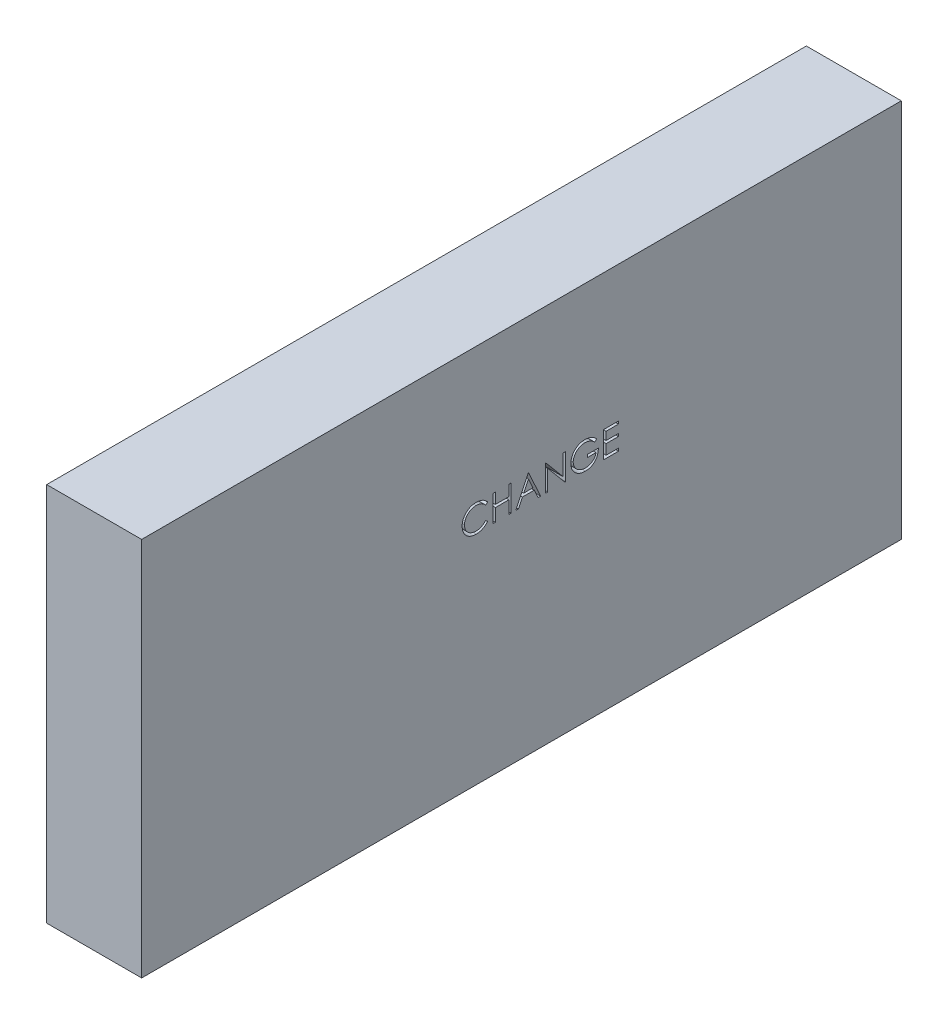
from build123d import *

# Parameters (mm, degrees)
SKETCH1_W          = 12.7
SKETCH1_H          = 50.8
EXTRUDE1_DEPTH     = 50.8
CUT_EXTRUDE1_DEPTH = 59.198711326


with BuildPart() as part:
    # Sketch1 → Extrude1 (new, symmetric)
    with BuildSketch(Plane.XY):
        Rectangle(SKETCH1_W, SKETCH1_H)
    extrude(amount=EXTRUDE1_DEPTH, both=True)

    # Sketch2 → Cut-Extrude1 (cut, through all)
    # profile 1 of 6: a face of its own
    with BuildSketch(Plane(origin=(6.35, 0, 0), x_dir=(0, 0, -1), z_dir=(1, 0, 0))):
        with BuildLine():
            Line((-4.524709295, 6.586952652), (-4.799549039, 6.376616113))
            add(Edge.make_bspline(
                [(-4.799549039, 6.376616113), (-4.819154927, 6.399982083), (-4.858102374, 6.446398999), (-4.920761577, 6.511578543), (-4.986063219, 6.572643805), (-5.053982341, 6.629885684), (-5.12574146, 6.68130245), (-5.199602259, 6.729573553), (-5.276800304, 6.772841291), (-5.383552039, 6.825304277), (-5.523199887, 6.880050432), (-5.698994726, 6.925953663), (-5.882505825, 6.955174839), (-6.007703424, 6.958339681), (-6.071383975, 6.959949447)],
                knots=[0, 0, 0, 0, 0.757959112, 1.505699292, 2.245454638, 2.979532153, 3.711538275, 4.438200793, 5.171680507, 5.909471876, 7.393775596, 8.890124382, 10.418191784, 12, 12, 12, 12], degree=3))
            add(Edge.make_bspline(
                [(-6.071383975, 6.959949447), (-6.106467274, 6.959545484), (-6.176308267, 6.958741308), (-6.27995674, 6.948132183), (-6.381669791, 6.933220973), (-6.481381258, 6.91109565), (-6.578964216, 6.883123031), (-6.675056618, 6.849697617), (-6.768267218, 6.808342777), (-6.859885456, 6.762634517), (-6.947664667, 6.711007072), (-7.030719715, 6.65469372), (-7.108747683, 6.594324624), (-7.181810295, 6.529673517), (-7.249982243, 6.461031557), (-7.312769554, 6.387667215), (-7.369954964, 6.309815042), (-7.422671989, 6.228501634), (-7.469884723, 6.143963843), (-7.509414602, 6.055888772), (-7.544419724, 5.965784669), (-7.572118967, 5.872633508), (-7.594043484, 5.777090743), (-7.609171147, 5.678899955), (-7.619659618, 5.578266275), (-7.620459795, 5.510056962), (-7.620863141, 5.475674607)],
                knots=[0, 0, 0, 0, 1.054917814, 2.100044995, 3.131103042, 4.146048494, 5.169673617, 6.183595914, 7.203665975, 8.234915748, 9.262203917, 10.264457458, 11.251630812, 12.227803204, 13.197192746, 14.159520551, 15.12972552, 16.100847026, 17.073214652, 18.039054194, 19.002613845, 19.979014051, 20.95965708, 21.949030935, 22.966165397, 24, 24, 24, 24], degree=3))
            add(Edge.make_bspline(
                [(-7.620863141, 5.475674607), (-7.619601322, 5.423943287), (-7.617123908, 5.322375702), (-7.595075574, 5.173605092), (-7.561570483, 5.031084418), (-7.511354906, 4.895704575), (-7.449435855, 4.765796217), (-7.371195244, 4.643557364), (-7.280578706, 4.527140799), (-7.176304287, 4.419297852), (-7.061898471, 4.320784126), (-6.939150559, 4.234033545), (-6.808366272, 4.161718662), (-6.670989641, 4.101542716), (-6.525963527, 4.055285988), (-6.373548725, 4.022721865), (-6.21407673, 4.001479684), (-6.10510733, 3.999445996), (-6.049649199, 3.998410985)],
                knots=[0, 0, 0, 0, 1.029171465, 2.020641659, 2.987623507, 3.938342917, 4.889210282, 5.84687017, 6.821220943, 7.821438502, 8.827599549, 9.822697543, 10.807740252, 11.797342354, 12.80366471, 13.83203677, 14.896651826, 16, 16, 16, 16], degree=3))
            add(Edge.make_bspline(
                [(-6.049649199, 3.998410985), (-5.98854651, 4.000099765), (-5.868281801, 4.003423687), (-5.691913775, 4.031582936), (-5.523078009, 4.077240854), (-5.361765423, 4.141138777), (-5.208430776, 4.224204065), (-5.062834116, 4.324901942), (-4.924852546, 4.444190275), (-4.841881263, 4.535273403), (-4.799549039, 4.581744318)],
                knots=[0, 0, 0, 0, 1.028121516, 2.023589091, 2.998037872, 3.967518031, 4.937445131, 5.927275754, 6.942489185, 8, 8, 8, 8], degree=3))
            Line((-4.799549039, 4.581744318), (-4.524709295, 4.373511145))
            add(Edge.make_bspline(
                [(-4.524709295, 4.373511145), (-4.546827405, 4.344972693), (-4.59095768, 4.288032487), (-4.662415697, 4.207760777), (-4.737692995, 4.132256742), (-4.817348705, 4.062129121), (-4.900466496, 3.995974655), (-4.988538809, 3.935672824), (-5.080407841, 3.880381939), (-5.17576232, 3.829755015), (-5.274500933, 3.784837768), (-5.376505368, 3.746384), (-5.481335943, 3.713259111), (-5.588997452, 3.686007174), (-5.699713209, 3.66473609), (-5.813083683, 3.650516415), (-5.929353558, 3.640774501), (-6.007794979, 3.639886585), (-6.047545834, 3.639436626)],
                knots=[0, 0, 0, 0, 0.986787822, 1.968848986, 2.935600012, 3.899624008, 4.868462664, 5.837806735, 6.815139263, 7.798259679, 8.787526145, 9.778297419, 10.776456485, 11.791383307, 12.812564526, 13.85620153, 14.913611965, 16, 16, 16, 16], degree=3))
            add(Edge.make_bspline(
                [(-6.047545834, 3.639436626), (-6.085189501, 3.639698619), (-6.159625191, 3.640216676), (-6.269523943, 3.648608844), (-6.376513523, 3.660058581), (-6.480288149, 3.677298712), (-6.581414124, 3.697643052), (-6.678974709, 3.724914309), (-6.773929919, 3.755463475), (-6.86589826, 3.791368462), (-6.95495796, 3.831884644), (-7.040821771, 3.877676203), (-7.123450203, 3.928358068), (-7.203655624, 3.982813078), (-7.280253208, 4.04279038), (-7.353906733, 4.107457015), (-7.425029209, 4.176595026), (-7.469031894, 4.226449879), (-7.491155609, 4.251515953)],
                knots=[0, 0, 0, 0, 1.114604814, 2.203992996, 3.262667896, 4.300477797, 5.318619304, 6.316056647, 7.298880507, 8.271930387, 9.238335007, 10.195173496, 11.151986948, 12.108099108, 13.064862484, 14.031167946, 15.010108607, 16, 16, 16, 16], degree=3))
            add(Edge.make_bspline(
                [(-7.491155609, 4.251515953), (-7.526591253, 4.295057142), (-7.59703473, 4.381613852), (-7.687160413, 4.521899834), (-7.764307968, 4.668368042), (-7.826683889, 4.821787971), (-7.875446622, 4.981815358), (-7.909227817, 5.148530873), (-7.931179422, 5.321778815), (-7.933689711, 5.439615604), (-7.934965706, 5.499512748)],
                knots=[0, 0, 0, 0, 0.994628077, 1.977248131, 2.950237994, 3.925870899, 4.908910175, 5.911660606, 6.938484602, 8, 8, 8, 8], degree=3))
            add(Edge.make_bspline(
                [(-7.934965706, 5.499512748), (-7.933410512, 5.562468201), (-7.930350766, 5.686329126), (-7.90435497, 5.868103079), (-7.862536174, 6.042254478), (-7.803139285, 6.208458223), (-7.727833934, 6.367588503), (-7.63480732, 6.518429708), (-7.525140178, 6.661946507), (-7.39969261, 6.795961259), (-7.262125275, 6.918500611), (-7.114806461, 7.026306815), (-6.958024514, 7.116024331), (-6.793506663, 7.191020494), (-6.620020981, 7.248664957), (-6.437937612, 7.289018143), (-6.247598697, 7.31413526), (-6.117736271, 7.317310468), (-6.051752565, 7.318923806)],
                knots=[0, 0, 0, 0, 1.032925535, 2.032216505, 3.007276963, 3.968222605, 4.92396291, 5.891752235, 6.871517503, 7.883894988, 8.900124299, 9.891468569, 10.874487609, 11.85992873, 12.854644235, 13.869047385, 14.917252991, 16, 16, 16, 16], degree=3))
            add(Edge.make_bspline(
                [(-6.051752565, 7.318923806), (-6.011538093, 7.318441667), (-5.931937595, 7.317487323), (-5.814184943, 7.308181181), (-5.699542616, 7.292667575), (-5.587931634, 7.271551505), (-5.478809018, 7.245344184), (-5.373008777, 7.211203885), (-5.26991009, 7.172167354), (-5.170163182, 7.127208888), (-5.074246632, 7.076742147), (-4.982190313, 7.021326523), (-4.894725454, 6.961030718), (-4.811236606, 6.896367542), (-4.733120395, 6.825968983), (-4.658158916, 6.751771387), (-4.588897838, 6.671637563), (-4.546144643, 6.615232629), (-4.524709295, 6.586952652)],
                knots=[0, 0, 0, 0, 1.096760587, 2.17092713, 3.219439832, 4.250915756, 5.268269357, 6.278326846, 7.281116186, 8.274029601, 9.260640565, 10.235837813, 11.203064059, 12.156899882, 13.114053108, 14.069676657, 15.032185724, 16, 16, 16, 16], degree=3))
        make_face()
    # profile 2 of 6: a face of its own
    with BuildSketch(Plane(origin=(6.35, 0, 0), x_dir=(0, 0, -1), z_dir=(1, 0, 0))):
        Polygon((-3.806760577, 7.229180216), (-3.492658013, 7.229180216), (-3.492658013, 5.79328278), (-1.697786218, 5.79328278), (-1.697786218, 7.229180216), (-1.383683654, 7.229180216), (-1.383683654, 3.729180216), (-1.697786218, 3.729180216), (-1.697786218, 5.434308421), (-3.492658013, 5.434308421), (-3.492658013, 3.729180216), (-3.806760577, 3.729180216), align=None)
    # profile 3 of 6: a face of its own
    with BuildSketch(Plane(origin=(6.35, 0, 0), x_dir=(0, 0, -1), z_dir=(1, 0, 0))):
        Polygon((0.949649679, 7.229180216), (2.565034294, 3.729180216), (2.22358798, 3.729180216), (1.706160096, 4.850975088), (0.119521474, 4.850975088), (-0.412629968, 3.729180216), (-0.755478526, 3.729180216), (0.904777884, 7.229180216), align=None)
        Polygon((0.923708173, 6.546988709), (0.28989407, 5.209949447), (1.540695352, 5.209949447), align=None, mode=Mode.SUBTRACT)
    # profile 4 of 6: a face of its own
    with BuildSketch(Plane(origin=(6.35, 0, 0), x_dir=(0, 0, -1), z_dir=(1, 0, 0))):
        Polygon((3.193239423, 3.729180216), (3.193239423, 7.229180216), (3.259144871, 7.229180216), (5.571444551, 4.474472684), (5.571444551, 7.229180216), (5.885547115, 7.229180216), (5.885547115, 3.729180216), (5.814032692, 3.729180216), (3.507341987, 6.477577652), (3.507341987, 3.729180216), align=None)
    # profile 5 of 6: a face of its own
    with BuildSketch(Plane(origin=(6.35, 0, 0), x_dir=(0, 0, -1), z_dir=(1, 0, 0))):
        with BuildLine():
            Line((10.058624038, 6.631824447), (9.789393269, 6.376616113))
            add(Edge.make_bspline(
                [(9.789393269, 6.376616113), (9.740674381, 6.422446976), (9.644398334, 6.513015839), (9.487438092, 6.630526834), (9.323674458, 6.731192934), (9.153961961, 6.813099171), (8.982503407, 6.878451931), (8.81157463, 6.924980072), (8.642928929, 6.954652609), (8.530761711, 6.958200978), (8.475491025, 6.959949447)],
                knots=[0, 0, 0, 0, 1.08915593, 2.152340314, 3.188132944, 4.216796309, 5.218260357, 6.173443236, 7.099959455, 8, 8, 8, 8], degree=3))
            add(Edge.make_bspline(
                [(8.475491025, 6.959949447), (8.441576325, 6.959535841), (8.373834885, 6.958709702), (8.273212941, 6.948165486), (8.173646304, 6.933000622), (8.075322929, 6.911058745), (7.978051642, 6.883249685), (7.88217075, 6.848464222), (7.787501396, 6.807908978), (7.694935314, 6.761046504), (7.605194811, 6.709566657), (7.520437975, 6.652518117), (7.440124576, 6.591729327), (7.365764151, 6.525678347), (7.296928964, 6.454963482), (7.231980593, 6.380900176), (7.173203297, 6.301464957), (7.120112132, 6.218119331), (7.072750513, 6.132327142), (7.03094186, 6.044914152), (6.995844772, 5.956170298), (6.968075316, 5.86598422), (6.945164662, 5.775053631), (6.929047055, 5.68274891), (6.919960333, 5.588971225), (6.918388553, 5.526173966), (6.917598397, 5.494604895)],
                knots=[0, 0, 0, 0, 1.02818874, 2.053710826, 3.065248034, 4.081641283, 5.106893873, 6.131558223, 7.173050175, 8.228653731, 9.27666206, 10.308777013, 11.325269123, 12.329503258, 13.32196095, 14.316845687, 15.314881793, 16.315733098, 17.311955233, 18.285320748, 19.252783886, 20.203351036, 21.145449891, 22.095197417, 23.042428769, 24, 24, 24, 24], degree=3))
            add(Edge.make_bspline(
                [(6.917598397, 5.494604895), (6.918354115, 5.462334078), (6.919863488, 5.397880564), (6.929523808, 5.301686492), (6.947452048, 5.206921089), (6.971419757, 5.113272956), (7.001400573, 5.020581708), (7.038773239, 4.929249199), (7.083038839, 4.839278807), (7.134275391, 4.75148119), (7.190461595, 4.665958167), (7.253404676, 4.585398645), (7.320265259, 4.508729868), (7.393479159, 4.437654104), (7.470698701, 4.370270208), (7.554230977, 4.308434686), (7.642433438, 4.250956463), (7.73544065, 4.198559943), (7.832243432, 4.151751408), (7.931500185, 4.110127512), (8.033528001, 4.075848174), (8.137790691, 4.04791007), (8.244163962, 4.025009773), (8.353187765, 4.010277293), (8.464060473, 3.999586462), (8.538799105, 3.998804792), (8.576452564, 3.998410985)],
                knots=[0, 0, 0, 0, 0.93586088, 1.869166235, 2.799637598, 3.729985548, 4.670839027, 5.622275134, 6.589130586, 7.576015415, 8.568469353, 9.55398029, 10.53834874, 11.515998671, 12.510579167, 13.508179873, 14.527009472, 15.561807829, 16.601455013, 17.643573243, 18.680854198, 19.719860599, 20.772568776, 21.833555941, 22.908541556, 24, 24, 24, 24], degree=3))
            add(Edge.make_bspline(
                [(8.576452564, 3.998410985), (8.621830911, 3.999359561), (8.710938668, 4.001222245), (8.841925111, 4.015722534), (8.967728182, 4.038369328), (9.087994385, 4.071535225), (9.202863406, 4.1138389), (9.312756347, 4.164834286), (9.416808006, 4.226477345), (9.515331179, 4.296051212), (9.606088365, 4.373566045), (9.687942489, 4.4572105), (9.759587978, 4.546578567), (9.822092677, 4.641143882), (9.873801332, 4.741689187), (9.916244127, 4.847721749), (9.948777418, 4.959289261), (9.962132393, 5.036380893), (9.968880448, 5.075334062)],
                knots=[0, 0, 0, 0, 1.13008108, 2.219097802, 3.278683437, 4.311054135, 5.322181354, 6.324827112, 7.324222904, 8.330512327, 9.32562643, 10.293043162, 11.24128371, 12.174520618, 13.111833804, 14.052305215, 15.015860969, 16, 16, 16, 16], degree=3))
            Line((9.968880448, 5.075334062), (8.802213782, 5.075334062))
            Line((8.802213782, 5.075334062), (8.802213782, 5.434308421))
            Line((8.802213782, 5.434308421), (10.282983012, 5.434308421))
            add(Edge.make_bspline(
                [(10.282983012, 5.434308421), (10.281277164, 5.367400932), (10.277938511, 5.23645089), (10.254519595, 5.04548062), (10.216703083, 4.865108926), (10.165042771, 4.695145855), (10.098167491, 4.535832262), (10.016794962, 4.387006396), (9.919622841, 4.249629715), (9.8101124, 4.122580711), (9.687212442, 4.009251499), (9.554243822, 3.909645561), (9.410986853, 3.825742946), (9.257577046, 3.757482283), (9.094516612, 3.704208288), (8.921428233, 3.666436712), (8.738546632, 3.643806748), (8.613209955, 3.640915369), (8.549108814, 3.639436626)],
                knots=[0, 0, 0, 0, 1.140356446, 2.231883559, 3.274166699, 4.278491846, 5.25512956, 6.21435461, 7.1637429, 8.11826594, 9.068280886, 10.0076534, 10.945064095, 11.891975133, 12.864533718, 13.863980011, 14.907571808, 16, 16, 16, 16], degree=3))
            add(Edge.make_bspline(
                [(8.549108814, 3.639436626), (8.509598678, 3.640005747), (8.431671957, 3.641128238), (8.316581029, 3.649105585), (8.204663409, 3.661386162), (8.0959354, 3.679931285), (7.989997058, 3.702645939), (7.887377473, 3.731732658), (7.787685731, 3.765401357), (7.690767745, 3.803697031), (7.597503198, 3.848068687), (7.507476681, 3.897378327), (7.420190556, 3.951371688), (7.336239391, 4.010982533), (7.255185769, 4.075764994), (7.177552326, 4.145848913), (7.102904448, 4.221020032), (7.056143984, 4.274399042), (7.032582371, 4.3012956)],
                knots=[0, 0, 0, 0, 1.107784379, 2.184907829, 3.233506516, 4.263428166, 5.276301166, 6.270063455, 7.25232949, 8.225834625, 9.190232166, 10.146266622, 11.1027726, 12.066435141, 13.031522626, 14.010570082, 14.99756817, 16, 16, 16, 16], degree=3))
            add(Edge.make_bspline(
                [(7.032582371, 4.3012956), (6.998396439, 4.343966253), (6.930592027, 4.428599271), (6.84331387, 4.564199215), (6.768912467, 4.704601075), (6.708544645, 4.850195704), (6.661406559, 5.000846916), (6.627600306, 5.156362208), (6.607793017, 5.316941838), (6.60493948, 5.425607103), (6.603495833, 5.480582459)],
                knots=[0, 0, 0, 0, 1.023165419, 2.029347347, 3.013907458, 3.994755782, 4.975994455, 5.96558838, 6.970761222, 8, 8, 8, 8], degree=3))
            add(Edge.make_bspline(
                [(6.603495833, 5.480582459), (6.604028071, 5.521748712), (6.605085783, 5.60355802), (6.617911299, 5.725015327), (6.636312717, 5.844316019), (6.663359772, 5.961362575), (6.697456036, 6.076233167), (6.740009522, 6.188981131), (6.789554418, 6.299673003), (6.847139915, 6.407546871), (6.911224374, 6.511171283), (6.980774594, 6.610129087), (7.056778195, 6.702618152), (7.137993994, 6.7898098), (7.225390984, 6.870608647), (7.318150408, 6.945762758), (7.416343751, 7.015372944), (7.520279931, 7.078342778), (7.628407615, 7.134906399), (7.740467617, 7.18449561), (7.856425728, 7.225478926), (7.975413205, 7.260252706), (8.098330706, 7.285967846), (8.224286243, 7.304616592), (8.353936355, 7.317377191), (8.441572384, 7.318403447), (8.486007852, 7.318923806)],
                knots=[0, 0, 0, 0, 1.008945113, 2.00506715, 2.99143336, 3.967273523, 4.948097931, 5.927297278, 6.919902385, 7.919676788, 8.923139349, 9.905703106, 10.883022732, 11.856032218, 12.825136022, 13.798837087, 14.781400844, 15.773989409, 16.776158564, 17.77167057, 18.775803737, 19.789618931, 20.80898985, 21.851988756, 22.910860228, 24, 24, 24, 24], degree=3))
            add(Edge.make_bspline(
                [(8.486007852, 7.318923806), (8.522246096, 7.318344314), (8.594102275, 7.31719525), (8.701028007, 7.309230602), (8.806301022, 7.296606721), (8.910077411, 7.279379934), (9.012003778, 7.255916243), (9.112370483, 7.227837959), (9.211323019, 7.195146136), (9.308551268, 7.15615729), (9.404708984, 7.111903665), (9.500330825, 7.062090243), (9.595090071, 7.005865238), (9.689151052, 6.943061702), (9.78310691, 6.874758285), (9.875471553, 6.799001461), (9.968474497, 6.718778705), (10.028276311, 6.661096521), (10.058624038, 6.631824447)],
                knots=[0, 0, 0, 0, 0.985871117, 1.954866573, 2.915460327, 3.869826059, 4.81536089, 5.759505086, 6.70452669, 7.649098992, 8.607881297, 9.583363685, 10.581137262, 11.603961102, 12.659522466, 13.73993555, 14.853081303, 16, 16, 16, 16], degree=3))
        make_face()
    # profile 6 of 6: a face of its own
    with BuildSketch(Plane(origin=(6.35, 0, 0), x_dir=(0, 0, -1), z_dir=(1, 0, 0))):
        Polygon((11.00093173, 7.229180216), (12.975290705, 7.229180216), (12.975290705, 6.870205857), (11.315034294, 6.870205857), (11.315034294, 5.79328278), (12.975290705, 5.79328278), (12.975290705, 5.434308421), (11.315034294, 5.434308421), (11.315034294, 4.088154575), (12.975290705, 4.088154575), (12.975290705, 3.729180216), (11.00093173, 3.729180216), align=None)
    extrude(amount=-CUT_EXTRUDE1_DEPTH, mode=Mode.SUBTRACT)


with BuildPart() as cut_extrude1_piece_1:
    # of the separate pieces the step leaves, piece 1, a body of its own (cut_extrude1_pieces)
    add(part.part.solids().sort_by_distance((-6.35, 25.4, -50.8))[0])


with BuildPart() as cut_extrude1_piece_2:
    # of the separate pieces the step leaves, piece 2, a body of its own (cut_extrude1_pieces)
    add(part.part.solids().sort_by_distance((-6.35, 5.209949447, -1.540695352))[0])


solid = Compound([cut_extrude1_piece_1.part, cut_extrude1_piece_2.part])
